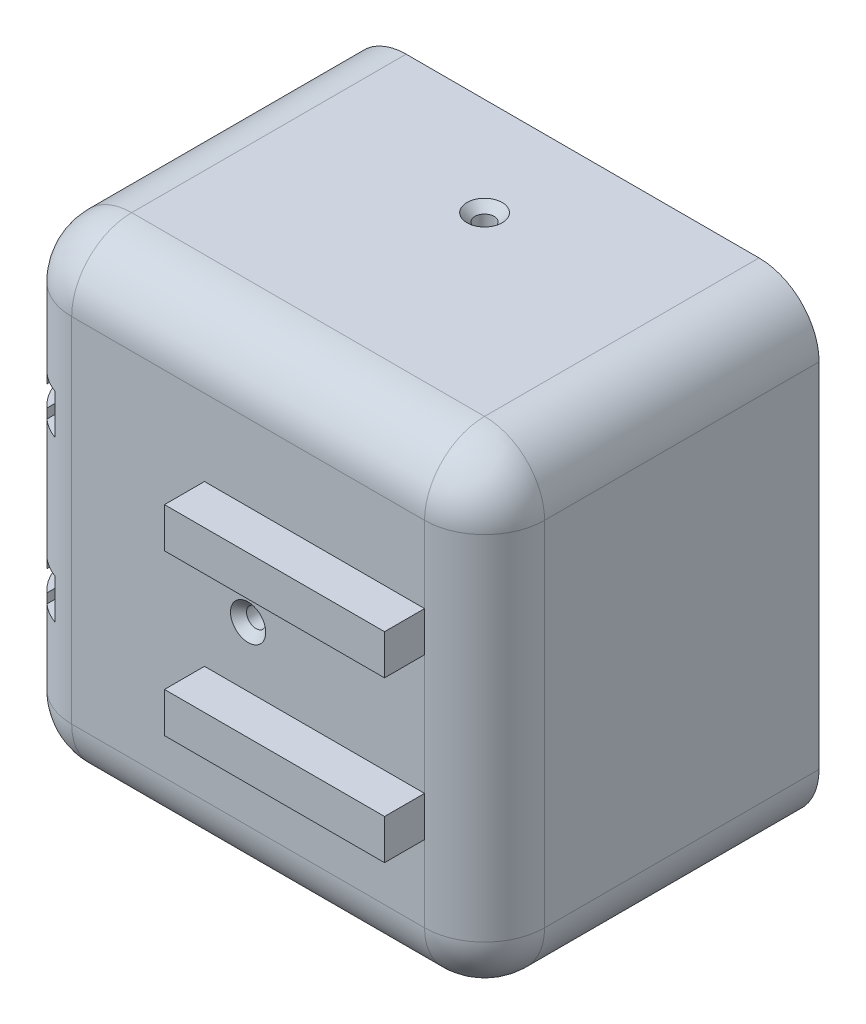
from build123d import *

# Parameters (mm, degrees)
SKETCH1_W                                            = 59.1
SKETCH1_H                                            = 59.1
BOSS_EXTRUDE1_DEPTH                                  = 59.1
CUT_EXTRUDE1_START                                   = -2.25
SKETCH2_W                                            = 116.357411776
SKETCH2_H                                            = 94.431830133
CUT_EXTRUDE1_DEPTH                                   = 71.232302632
FILLET1_R                                            = 7.5
SHELL1_T                                             = -2.5
CUT_EXTRUDE7_DEPTH                                   = 35
BOSS_EXTRUDE2_START                                  = 3
SKETCH18_R                                           = 5
BOSS_EXTRUDE2_DEPTH                                  = 3
SKETCH17_R                                           = 1.5
CUT_EXTRUDE10_DEPTH                                  = 10
CUT_EXTRUDE11_REACH                                  = 90.65
CSK_SLOT_FOR_M2_COUNTERSUNK_FLAT_HEAD_SC_D           = 2.4
CSK_SLOT_FOR_M2_COUNTERSUNK_FLAT_HEAD_SC_CSINK_D     = 4.4
CSK_SLOT_FOR_M2_COUNTERSUNK_FLAT_HEAD_SC_CSINK_ANGLE = 90
CSK_SLOT_FOR_M2_COUNTERSUNK_FLAT_HEA_2_D             = 2.4
CSK_SLOT_FOR_M2_COUNTERSUNK_FLAT_HEA_2_CSINK_D       = 4.4
CSK_SLOT_FOR_M2_COUNTERSUNK_FLAT_HEA_2_CSINK_ANGLE   = 90
CSK_SLOT_FOR_M2_COUNTERSUNK_FLAT_HEA_3_D             = 2.4
CSK_SLOT_FOR_M2_COUNTERSUNK_FLAT_HEA_3_CSINK_D       = 4.4
CSK_SLOT_FOR_M2_COUNTERSUNK_FLAT_HEA_3_CSINK_ANGLE   = 90
BOSS_EXTRUDE3_DEPTH                                  = 35
SKETCH28_W                                           = 7.5
SKETCH28_H                                           = 5.1
CUT_EXTRUDE12_DEPTH                                  = 62.984090748
SKETCH29_W                                           = 27.5
SKETCH29_H                                           = 5
BOSS_EXTRUDE4_DEPTH                                  = 5


with BuildPart() as part:
    # Sketch1 → Boss-Extrude1 (new body)
    with BuildSketch(Plane.XY):
        Rectangle(SKETCH1_W, SKETCH1_H)
    extrude(amount=BOSS_EXTRUDE1_DEPTH)

    # Sketch2 → Cut-Extrude1 (cut, through all)
    with BuildSketch(Plane(origin=(-13.400446417, -13.400446417, 19.55), x_dir=(0.9659258262890684, -0.2588190451025203, 0), z_dir=(0, 0, 1)).offset(CUT_EXTRUDE1_START)):
        with Locations((15.241895832, 15.980077556)):
            Rectangle(SKETCH2_W, SKETCH2_H)
    extrude(amount=-CUT_EXTRUDE1_DEPTH, mode=Mode.SUBTRACT)

    # Fillet1
    fillet1_edges = [part.edges().sort_by_distance(p)[0] for p in [
        (29.55, 0, 59.1),
        (0, 29.55, 59.1),
        (-29.55, 0, 59.1),
        (0, -29.55, 59.1),
        (-29.55, 29.55, 38.2),
        (29.55, 29.55, 38.2),
        (29.55, -29.55, 38.2),
        (-29.55, -29.55, 38.2),
    ]]
    fillet(fillet1_edges, radius=FILLET1_R)

    # Shell1
    shell1_openings = [part.faces().sort_by_distance(p)[0] for p in [
        (0, 0, 17.3),
    ]]
    offset(amount=SHELL1_T, openings=shell1_openings, kind=Kind.INTERSECTION)

    # Sketch14 → Cut-Extrude7 (cut)
    with BuildSketch(Plane.XY.offset(59.1)):
        Polygon((-29.55, -8.7), (-27.05, -8.7), (-27.05, -7.5), (-24.55, -7.5), (-24.55, -12.5), (-27.05, -12.5), (-27.05, -11.3), (-29.55, -11.3), align=None)
        Polygon((-29.55, 11.3), (-29.55, 8.7), (-27.05, 8.7), (-27.05, 7.5), (-24.55, 7.5), (-24.55, 12.5), (-27.05, 12.5), (-27.05, 11.3), align=None)
    extrude(amount=-CUT_EXTRUDE7_DEPTH, mode=Mode.SUBTRACT)

    # Sketch18 → Boss-Extrude2 (add)
    with BuildSketch(Plane(origin=(0, -27.05, 0), x_dir=(1, 0, 0), z_dir=(0, 1, 0)).offset(BOSS_EXTRUDE2_START)):
        with Locations((-22.05, -51.6)):
            Circle(SKETCH18_R)
    extrude(amount=-BOSS_EXTRUDE2_DEPTH)

    # Sketch17 → Cut-Extrude10 (cut)
    with BuildSketch(Plane.XZ.offset(29.55)):
        with Locations(Location((-22.05, 51.6, 0), (0, 0, 90))):
            Circle(SKETCH17_R)
    extrude(amount=-CUT_EXTRUDE10_DEPTH, mode=Mode.SUBTRACT)

    # Sketch20 → Cut-Extrude11 (cut, up to next)
    with BuildSketch(Plane.XZ.offset(29.55), mode=Mode.PRIVATE) as cut_extrude11_sk1:
        with BuildLine():
            Line((-22.647878988, 52.975696447), (-23.072143057, 53.399960516))
            Line((-23.072143057, 53.399960516), (-23.849960516, 52.622143057))
            Line((-23.849960516, 52.622143057), (-23.425696447, 52.197878988))
            ThreePointArc((-23.425696447, 52.197878988), (-23.110660172, 52.660660172), (-22.647878988, 52.975696447))
        make_face()
    cut_extrude11_tool1 = extrude(cut_extrude11_sk1.sketch, amount=-CUT_EXTRUDE11_REACH, mode=Mode.PRIVATE) & part.part
    # Sketch20 → Cut-Extrude11 (cut, up to next)
    with BuildSketch(Plane.XZ.offset(29.55), mode=Mode.PRIVATE) as cut_extrude11_sk2:
        with BuildLine():
            Line((-21.027856943, 49.800039484), (-21.452121012, 50.224303553))
            ThreePointArc((-21.452121012, 50.224303553), (-20.989339828, 50.539339828), (-20.674303553, 51.002121012))
            Line((-20.674303553, 51.002121012), (-20.250039484, 50.577856943))
            Line((-20.250039484, 50.577856943), (-21.027856943, 49.800039484))
        make_face()
    cut_extrude11_tool2 = extrude(cut_extrude11_sk2.sketch, amount=-CUT_EXTRUDE11_REACH, mode=Mode.PRIVATE) & part.part
    add(cut_extrude11_tool1.solids().sort_by_distance((-23.27308, -29.55, 52.82308))[0], mode=Mode.SUBTRACT)
    add(cut_extrude11_tool2.solids().sort_by_distance((-20.82692, -29.55, 50.37692))[0], mode=Mode.SUBTRACT)

    # CSK SLOT for M2 Countersunk Flat Head Sc (through all)
    with Locations(Plane.ZX.offset(29.55)):
        with Locations((29.55, 0)):
            CounterSinkHole(CSK_SLOT_FOR_M2_COUNTERSUNK_FLAT_HEAD_SC_D / 2, CSK_SLOT_FOR_M2_COUNTERSUNK_FLAT_HEAD_SC_CSINK_D / 2, counter_sink_angle=CSK_SLOT_FOR_M2_COUNTERSUNK_FLAT_HEAD_SC_CSINK_ANGLE)

    # CSK SLOT for M2 Countersunk Flat Hea 2 (through all)
    with Locations(Plane.XY.offset(59.1)):
        with Locations((0, 0)):
            CounterSinkHole(CSK_SLOT_FOR_M2_COUNTERSUNK_FLAT_HEA_2_D / 2, CSK_SLOT_FOR_M2_COUNTERSUNK_FLAT_HEA_2_CSINK_D / 2, counter_sink_angle=CSK_SLOT_FOR_M2_COUNTERSUNK_FLAT_HEA_2_CSINK_ANGLE)

    # CSK SLOT for M2 Countersunk Flat Hea 3 (through all)
    with Locations(Plane(origin=(0, -29.55, 0), x_dir=(-1, 0, 0), z_dir=(0, -1, 0))):
        with Locations((0, -29.55)):
            CounterSinkHole(CSK_SLOT_FOR_M2_COUNTERSUNK_FLAT_HEA_3_D / 2, CSK_SLOT_FOR_M2_COUNTERSUNK_FLAT_HEA_3_CSINK_D / 2, counter_sink_angle=CSK_SLOT_FOR_M2_COUNTERSUNK_FLAT_HEA_3_CSINK_ANGLE)

    # Sketch27 → Boss-Extrude3 (add)
    with BuildSketch(Plane(origin=(-29.55, 29.55, 0), x_dir=(0, 0, -1), z_dir=(1, 0, 0))):
        Polygon((-18.3, -59.1), (-18.3, -61.7), (-17.05, -61.7), (-17.05, -64.2), (-22.05, -64.2), (-22.05, -61.7), (-20.8, -61.7), (-20.8, -59.1), align=None)
        Polygon((-38.3, -59.1), (-40.8, -59.1), (-40.8, -61.7), (-42.05, -61.7), (-42.05, -64.2), (-37.05, -64.2), (-37.05, -61.7), (-38.3, -61.7), align=None)
    extrude(amount=BOSS_EXTRUDE3_DEPTH)

    # Sketch28 → Cut-Extrude12 (cut, through all)
    with BuildSketch(Plane.XY.offset(59.1)):
        with Locations((-25.8, -32.1)):
            Rectangle(SKETCH28_W, SKETCH28_H)
    extrude(amount=-CUT_EXTRUDE12_DEPTH, mode=Mode.SUBTRACT)

    # Sketch29 → Boss-Extrude4 (add)
    with BuildSketch(Plane.XY.offset(59.1)):
        with Locations((8.3, -10)):
            Rectangle(SKETCH29_W, SKETCH29_H)
        with Locations((8.3, 10)):
            Rectangle(SKETCH29_W, SKETCH29_H)
    extrude(amount=BOSS_EXTRUDE4_DEPTH)


solid = part.part
